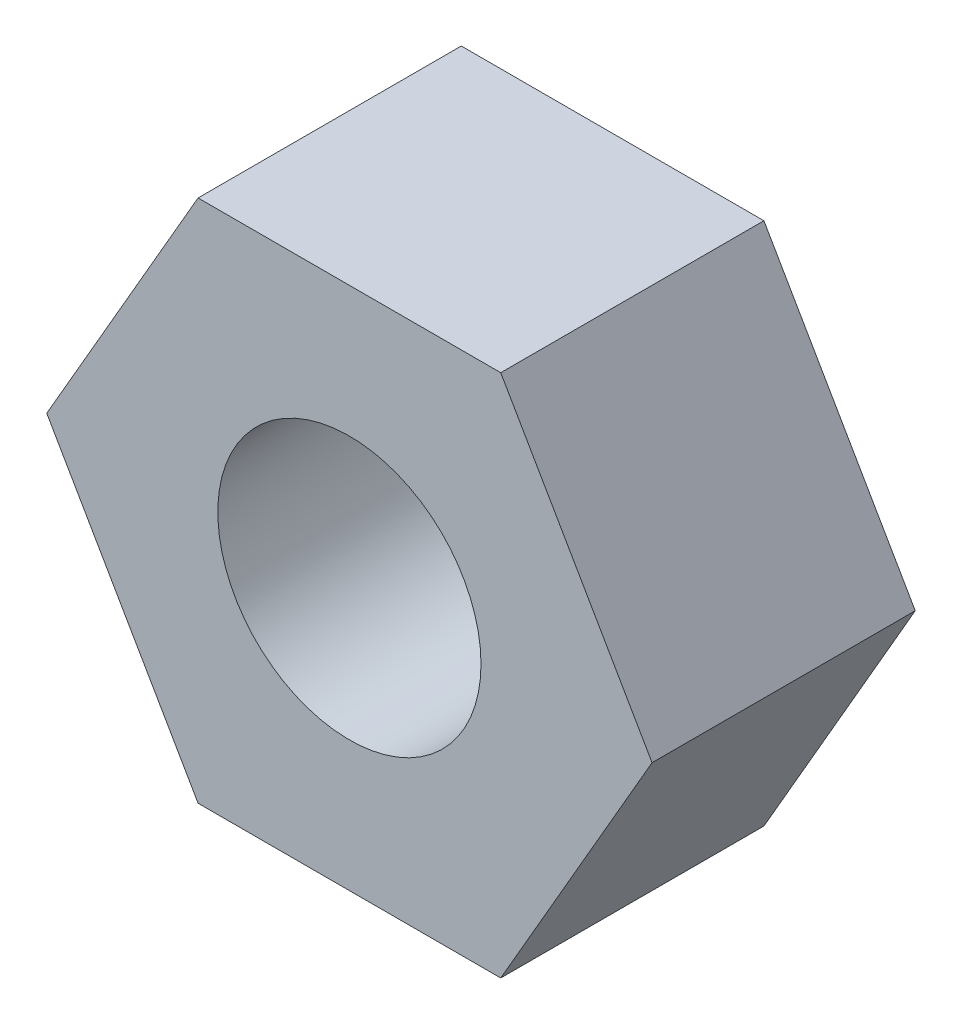
from build123d import *

# Parameters (mm, degrees)
BOSS_EXTRUDE1_DEPTH = 10
SKETCH2_R           = 5
CUT_EXTRUDE1_DEPTH  = 10


with BuildPart() as part:
    # Sketch1 → Boss-Extrude1 (new body)
    with BuildSketch(Plane.XY):
        Polygon((5.75, 9.959292144), (-5.75, 9.959292144), (-11.5, 0), (-5.75, -9.959292144), (5.75, -9.959292144), (11.5, 0), align=None)
    extrude(amount=BOSS_EXTRUDE1_DEPTH)

    # Sketch2 → Cut-Extrude1 (cut)
    with BuildSketch(Plane.XY.offset(10)):
        Circle(SKETCH2_R)
    extrude(amount=-CUT_EXTRUDE1_DEPTH, mode=Mode.SUBTRACT)


solid = part.part
